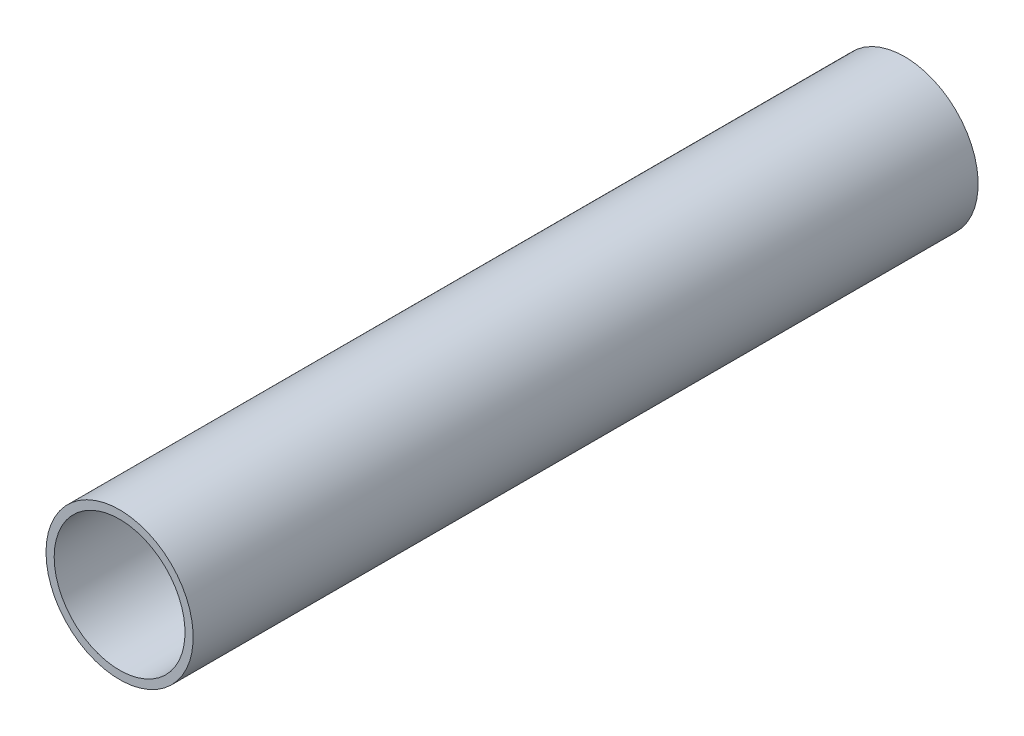
from build123d import *

# Parameters (mm, degrees)
SKETCH3_R           = 57.15
SKETCH3_R_2         = 50.8
BOSS_EXTRUDE1_DEPTH = 304.8


with BuildPart() as part:
    # Sketch3 → Boss-Extrude1 (new, symmetric)
    with BuildSketch(Plane.XY):
        with Locations(Location((0, 0, 0), (0, 0, 180))):
            Circle(SKETCH3_R)
        with Locations(Location((0, 0, 0), (0, 0, 180))):
            Circle(SKETCH3_R_2, mode=Mode.SUBTRACT)
    extrude(amount=BOSS_EXTRUDE1_DEPTH, both=True)


solid = part.part
